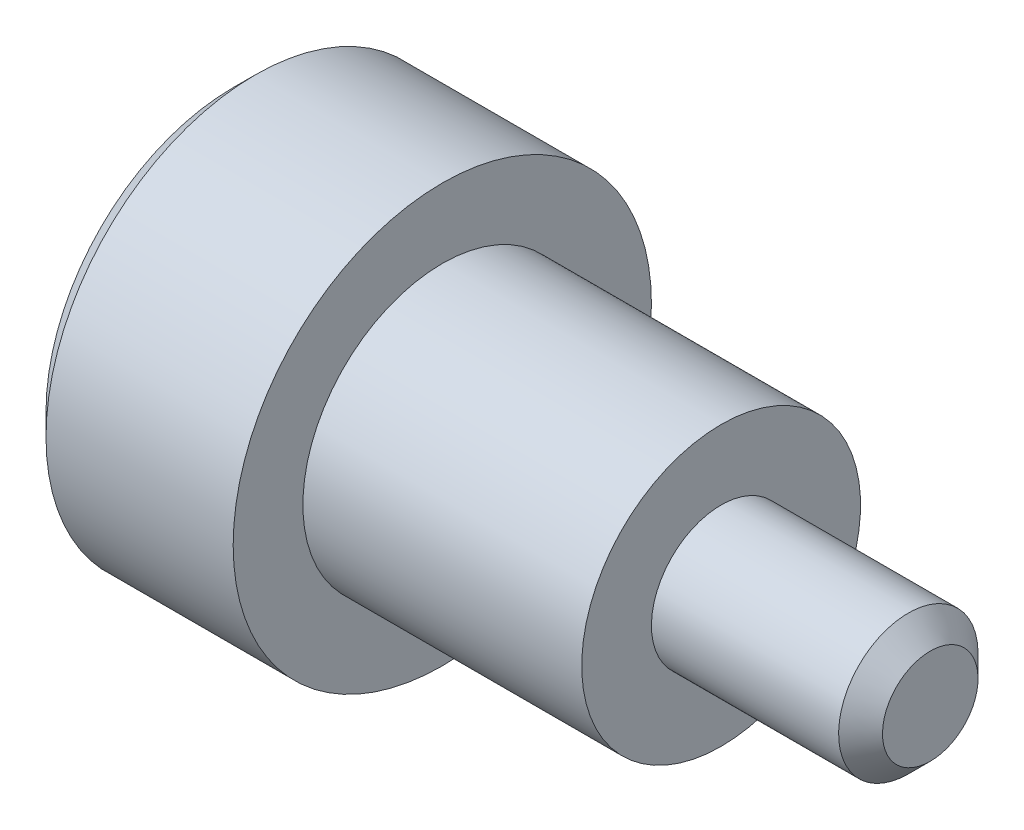
from build123d import *

# Parameters (mm, degrees)
CUT_EXTRUDE1_DEPTH = 2


with BuildPart() as part:
    # Sketch1 → Revolve1 (revolve)
    with BuildSketch(Plane.XY, mode=Mode.PRIVATE) as revolve1_sk:
        Polygon((0, 0), (0, 4.2625), (0.5, 4.7625), (4.7625, 4.7625), (4.7625, 3.175), (11.1125, 3.175), (11.1125, 1.5875), (15.375, 1.5875), (15.875, 1.0875), (15.875, 0), align=None)
    revolve(revolve1_sk.sketch.rotate(Axis((15.875, 0, 0), (-1, 0, 0)), 180), axis=Axis((15.875, 0, 0), (-1, 0, 0)))

    # Sketch2 → Cut-Revolve1 (revolve, cut)
    with BuildSketch(Plane.XY, mode=Mode.PRIVATE) as cut_revolve1_sk:
        Polygon((0, 0), (0, 1), (2, 1), (2.577350269, 0), align=None)
    revolve(cut_revolve1_sk.sketch.rotate(Axis((2.577350269, 0, 0), (-1, 0, 0)), 180), axis=Axis((2.577350269, 0, 0), (-1, 0, 0)), mode=Mode.SUBTRACT)

    # Sketch3 → Cut-Extrude1 (cut)
    with BuildSketch(Plane(origin=(0, 0, 0), x_dir=(0, 0, -1), z_dir=(1, 0, 0))):
        Polygon((-1, 0.577350269), (-1, -0.577350269), (0, -1.154700538), (1, -0.577350269), (1, 0.577350269), (0, 1.154700538), align=None)
    extrude(amount=CUT_EXTRUDE1_DEPTH, mode=Mode.SUBTRACT)


solid = part.part
